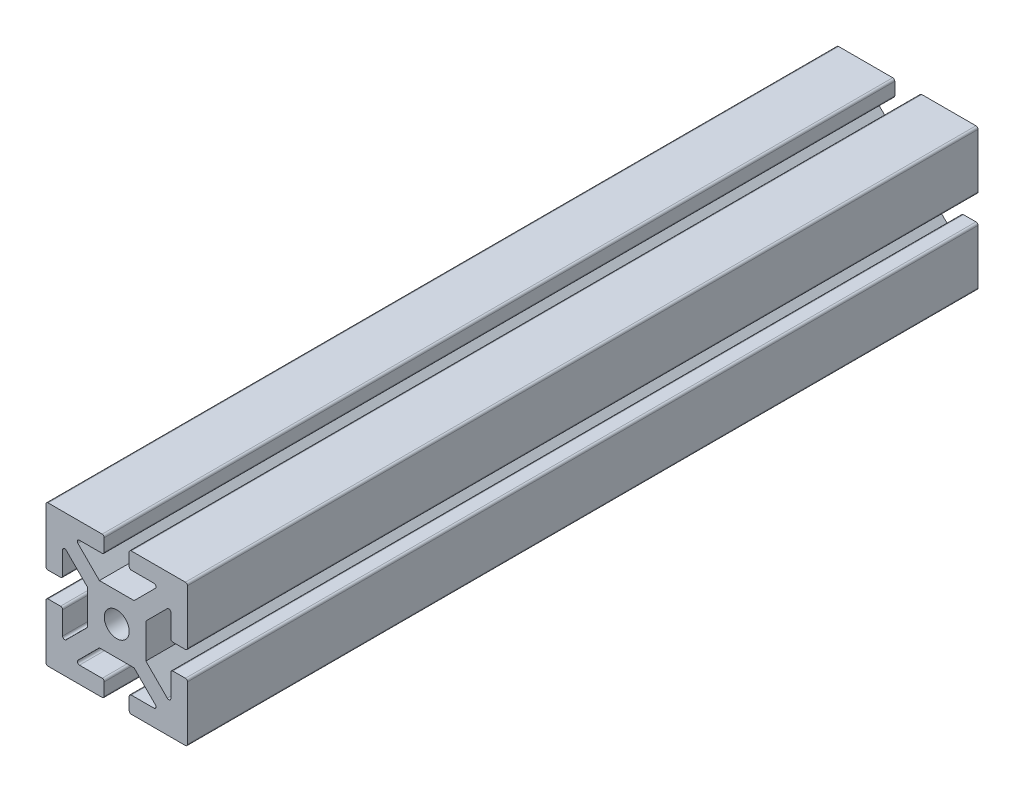
from build123d import *

# Parameters (mm, degrees)
SKETCH1_W           = 7
SKETCH1_H           = 7
SKETCH1_R           = 1.5
BOSS_EXTRUDE1_DEPTH = 95
FILLET1_R           = 0.25


with BuildPart() as part:
    # Sketch1 → Boss-Extrude1 (new body)
    # profile 1 of 9: a face of its own
    with BuildSketch(Plane.XY):
        Polygon((-6.5, -1.5), (-6.5, -6.5), (-1.5, -6.5), (-1.5, -8.5), (-8.5, -8.5), (-8.5, -1.5), align=None)
    # profile 2 of 9: a face of its own
    with BuildSketch(Plane.XY):
        Polygon((6.5, -1.5), (8.5, -1.5), (8.5, -8.5), (1.5, -8.5), (1.5, -6.5), (6.5, -6.5), align=None)
    # profile 3 of 9: a face of its own
    with BuildSketch(Plane.XY):
        Polygon((6.5, -5.085786438), (3.5, -2.085786438), (3.5, -3.5), (2.085786438, -3.5), (5.085786438, -6.5), (6.5, -6.5), align=None)
    # profile 4 of 9: a face of its own
    with BuildSketch(Plane.XY):
        Polygon((-3.5, -3.5), (-3.5, -2.085786438), (-6.5, -5.085786438), (-6.5, -6.5), (-5.085786438, -6.5), (-2.085786438, -3.5), align=None)
    # profile 5 of 9: a face of its own
    with BuildSketch(Plane.XY):
        Rectangle(SKETCH1_W, SKETCH1_H)
        Circle(SKETCH1_R, mode=Mode.SUBTRACT)
    # profile 6 of 9: a face of its own
    with BuildSketch(Plane.XY):
        Polygon((-3.5, 3.5), (-2.085786438, 3.5), (-5.085786438, 6.5), (-6.5, 6.5), (-6.5, 5.085786438), (-3.5, 2.085786438), align=None)
    # profile 7 of 9: a face of its own
    with BuildSketch(Plane.XY):
        Polygon((-6.5, 1.5), (-8.5, 1.5), (-8.5, 8.5), (-1.5, 8.5), (-1.5, 6.5), (-6.5, 6.5), align=None)
    # profile 8 of 9: a face of its own
    with BuildSketch(Plane.XY):
        Polygon((6.5, 6.5), (6.5, 1.5), (8.5, 1.5), (8.5, 8.5), (1.5, 8.5), (1.5, 6.5), align=None)
    # profile 9 of 9: a face of its own
    with BuildSketch(Plane.XY):
        Polygon((5.085786438, 6.5), (2.085786438, 3.5), (3.5, 3.5), (3.5, 2.085786438), (6.5, 5.085786438), (6.5, 6.5), align=None)
    extrude(amount=BOSS_EXTRUDE1_DEPTH)

    # Fillet1
    fillet1_edges = [part.edges().sort_by_distance(p)[0] for p in [
        (5.085786438, 6.5, 47.5),
        (1.5, 6.5, 47.5),
        (1.5, 8.5, 47.5),
        (8.5, 8.5, 47.5),
        (8.5, 1.5, 47.5),
        (6.5, 1.5, 47.5),
        (6.5, 5.085786438, 47.5),
        (6.5, -5.085786438, 47.5),
        (6.5, -1.5, 47.5),
        (8.5, -1.5, 47.5),
        (8.5, -8.5, 47.5),
        (1.5, -8.5, 47.5),
        (1.5, -6.5, 47.5),
        (5.085786438, -6.5, 47.5),
        (-5.085786438, -6.5, 47.5),
        (-1.5, -6.5, 47.5),
        (-1.5, -8.5, 47.5),
        (-8.5, -8.5, 47.5),
        (-8.5, -1.5, 47.5),
        (-6.5, -1.5, 47.5),
        (-6.5, -5.085786438, 47.5),
        (-6.5, 5.085786438, 47.5),
        (-6.5, 1.5, 47.5),
        (-8.5, 1.5, 47.5),
        (-8.5, 8.5, 47.5),
        (-1.5, 8.5, 47.5),
        (-1.5, 6.5, 47.5),
        (-5.085786438, 6.5, 47.5),
    ]]
    fillet(fillet1_edges, radius=FILLET1_R)


solid = part.part
